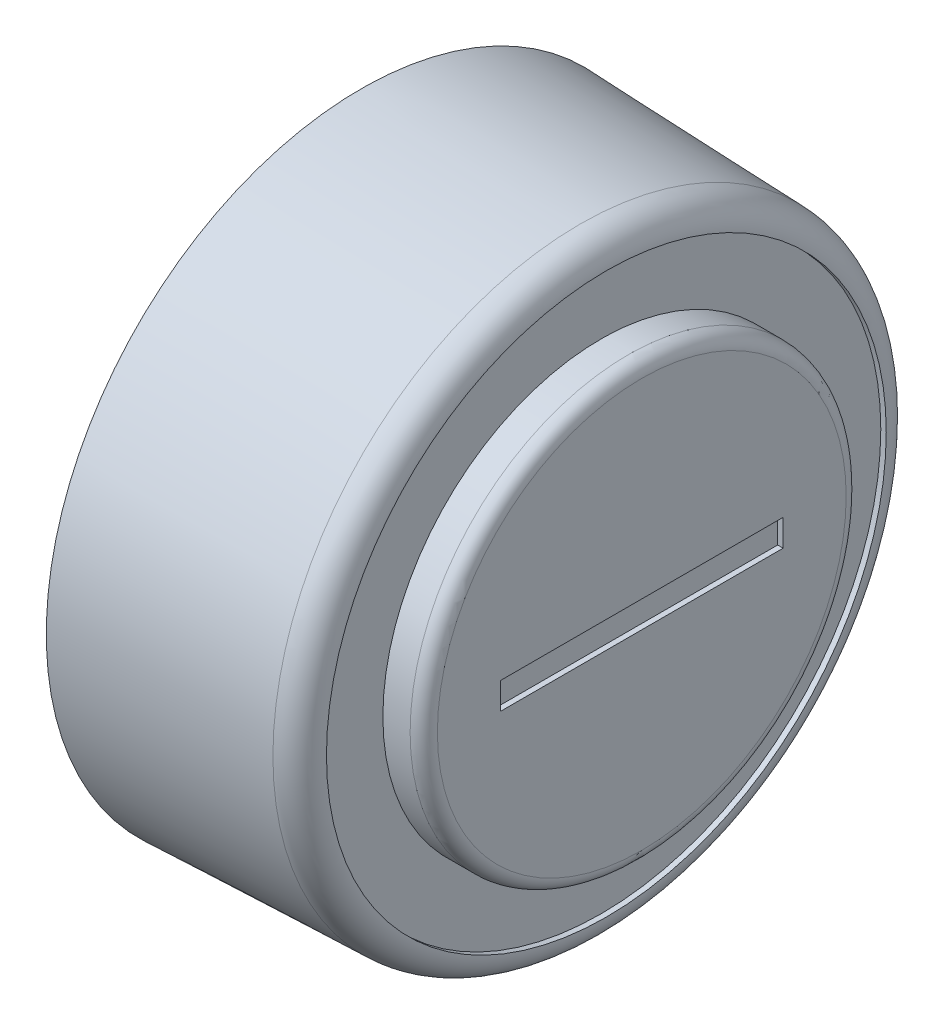
from build123d import *

# Parameters (mm, degrees)
SKETCH1_R           = 5.775
BOSS_EXTRUDE1_DEPTH = 4.5
BOSS_EXTRUDE1_TAPER = 2
SKETCH2_R           = 4
BOSS_EXTRUDE2_DEPTH = 5.15
FILLET1_R           = 0.5
FILLET2_R           = 0.25
CUT_EXTRUDE1_START  = -0.1
SKETCH3_R           = 5.13501215
SKETCH3_R_2         = 4
CUT_EXTRUDE1_DEPTH  = 0.1
CUT_EXTRUDE2_DEPTH  = 0.1
SKETCH5_W           = 5.187150014
SKETCH5_H           = 0.489897502
CUT_EXTRUDE3_DEPTH  = 0.1


with BuildPart() as part:
    # Sketch1 → Boss-Extrude1 (new body)
    with BuildSketch(Plane(origin=(0, 0, 0), x_dir=(0, 0, -1), z_dir=(1, 0, 0))):
        Circle(SKETCH1_R)
    extrude(amount=BOSS_EXTRUDE1_DEPTH, taper=BOSS_EXTRUDE1_TAPER)

    # Sketch2 → Boss-Extrude2 (add)
    with BuildSketch(Plane.ZY):
        Circle(SKETCH2_R)
    extrude(amount=-BOSS_EXTRUDE2_DEPTH)

    # Fillet1
    fillet1_edges = [part.edges().sort_by_distance(p)[0] for p in [
        (4.5, 0, 5.617856537),
    ]]
    fillet(fillet1_edges, radius=FILLET1_R)

    # Fillet2
    fillet2_edges = [part.edges().sort_by_distance(p)[0] for p in [
        (5.15, 0, -4),
    ]]
    fillet(fillet2_edges, radius=FILLET2_R)

    # Sketch3 → Cut-Extrude1 (cut)
    with BuildSketch(Plane(origin=(4.5, 0, 0), x_dir=(0, 0, -1), z_dir=(1, 0, 0)).offset(CUT_EXTRUDE1_START)):
        Circle(SKETCH3_R)
        with Locations(Location((0, 0, 0), (0, 0, 180))):
            Circle(SKETCH3_R_2, mode=Mode.SUBTRACT)
    extrude(amount=CUT_EXTRUDE1_DEPTH, mode=Mode.SUBTRACT)

    # Sketch4 → Cut-Extrude2 (cut)
    with BuildSketch(Plane.ZY):
        Polygon((-0.273766251, -2.535940007), (0.273766251, -2.535940007), (0.273766251, -0.280846858), (2.456875417, -0.280846858), (2.456875417, 0.280846858), (0.273766251, 0.280846858), (0.273766251, 2.535940007), (-0.273766251, 2.535940007), (-0.273766251, 0.280846858), (-2.456875417, 0.280846858), (-2.456875417, -0.280846858), (-0.273766251, -0.280846858), align=None)
    extrude(amount=-CUT_EXTRUDE2_DEPTH, mode=Mode.SUBTRACT)

    # Sketch5 → Cut-Extrude3 (cut)
    with BuildSketch(Plane(origin=(5.15, 0, 0), x_dir=(0, 0, -1), z_dir=(1, 0, 0))):
        Rectangle(SKETCH5_W, SKETCH5_H)
    extrude(amount=-CUT_EXTRUDE3_DEPTH, mode=Mode.SUBTRACT)


solid = part.part
